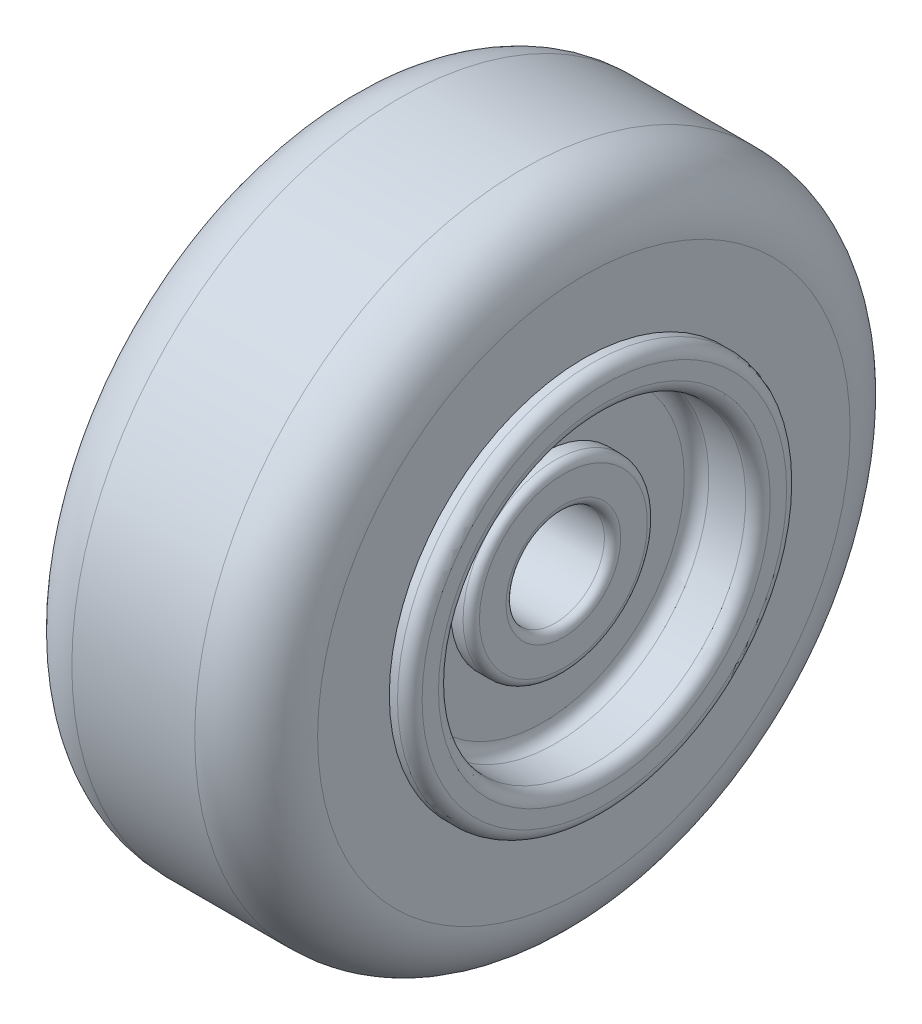
from build123d import *


with BuildPart() as part:
    # Esboço2 → Revolução1 (revolve)
    with BuildSketch(Plane.XY, mode=Mode.PRIVATE) as revolu_o1_sk:
        with BuildLine():
            Line((-2.3, 1.2), (2.3, 1.2))
            ThreePointArc((2.3, 1.2), (2.441421356, 1.258578644), (2.5, 1.4))
            Line((2.5, 1.4), (2.5, 2.05))
            ThreePointArc((2.5, 2.05), (2.441421356, 2.191421356), (2.3, 2.25))
            Line((2.3, 2.25), (2, 2.25))
            Line((2, 2.25), (2, 3.45))
            ThreePointArc((2, 3.45), (2.087867966, 3.662132034), (2.3, 3.75))
            Line((2.3, 3.75), (3.2, 3.75))
            ThreePointArc((3.2, 3.75), (3.412132034, 3.837867966), (3.5, 4.05))
            Line((3.5, 4.05), (3.5, 4.45))
            ThreePointArc((3.5, 4.45), (3.412132034, 4.662132034), (3.2, 4.75))
            Line((3.2, 4.75), (3, 4.75))
            Line((3, 4.75), (3, 6.5))
            ThreePointArc((3, 6.5), (2.560660172, 7.560660172), (1.5, 8))
            Line((1.5, 8), (-1.5, 8))
            ThreePointArc((-1.5, 8), (-2.560660172, 7.560660172), (-3, 6.5))
            Line((-3, 6.5), (-3, 4.75))
            Line((-3, 4.75), (-3.2, 4.75))
            ThreePointArc((-3.2, 4.75), (-3.412132034, 4.662132034), (-3.5, 4.45))
            Line((-3.5, 4.45), (-3.5, 4.05))
            ThreePointArc((-3.5, 4.05), (-3.412132034, 3.837867966), (-3.2, 3.75))
            Line((-3.2, 3.75), (-2.3, 3.75))
            ThreePointArc((-2.3, 3.75), (-2.087867966, 3.662132034), (-2, 3.45))
            Line((-2, 3.45), (-2, 2.25))
            Line((-2, 2.25), (-2.3, 2.25))
            ThreePointArc((-2.3, 2.25), (-2.441421356, 2.191421356), (-2.5, 2.05))
            Line((-2.5, 2.05), (-2.5, 1.4))
            ThreePointArc((-2.5, 1.4), (-2.441421356, 1.258578644), (-2.3, 1.2))
        make_face()
    revolve(revolu_o1_sk.sketch.rotate(Axis((0, 0, 0), (1, 0, 0)), 90), axis=Axis((0, 0, 0), (1, 0, 0)))


solid = part.part
